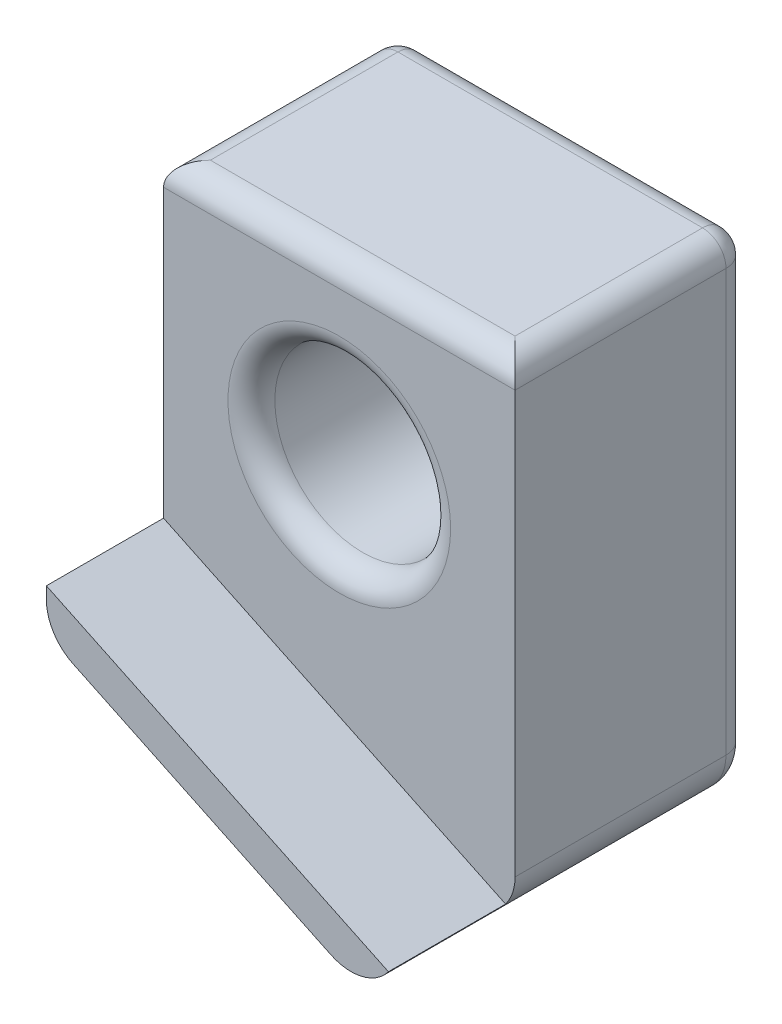
from build123d import *

# Parameters (mm, degrees)
SKETCH1_R           = 3.75
BOSS_EXTRUDE1_DEPTH = 10
BOSS_EXTRUDE2_DEPTH = 10
BOSS_EXTRUDE3_DEPTH = 5
FILLET1_R           = 2
FILLET2_R           = 1


with BuildPart() as part:
    # Sketch1 → Boss-Extrude1 (new body)
    with BuildSketch(Plane.XY):
        with BuildLine():
            Line((-7.5, 0), (-7.5, 7.5))
            Line((-7.5, 7.5), (7.5, 7.5))
            Line((7.5, 7.5), (7.5, 0))
            ThreePointArc((7.5, 0), (0, -7.5), (-7.5, 0))
        make_face()
        Circle(SKETCH1_R, mode=Mode.SUBTRACT)
    extrude(amount=BOSS_EXTRUDE1_DEPTH)

    # Sketch2 → Boss-Extrude2 (add, through all)
    with BuildSketch(Plane(origin=(0, 0, 0), x_dir=(-1, 0, 0), z_dir=(0, 0, -1))):
        with BuildLine():
            Line((-7.5, 0), (-7.5, -14.658730789))
            Line((-7.5, -14.658730789), (7.5, -7.501392953))
            Line((7.5, -7.501392953), (7.5, 0))
            ThreePointArc((7.5, 0), (0, -7.5), (-7.5, 0))
        make_face()
    extrude(amount=-BOSS_EXTRUDE2_DEPTH)

    # Sketch3 → Boss-Extrude3 (add)
    with BuildSketch(Plane.XY.offset(10)):
        Polygon((7.5, -12.885920889), (7.5, -14.658730789), (-7.5, -7.501392953), (-7.5, -5.728583054), align=None)
    extrude(amount=BOSS_EXTRUDE3_DEPTH)

    # Fillet1
    fillet1_edges = [part.edges().sort_by_distance(p)[0] for p in [
        (-7.5, -7.501392953, 7.5),
        (7.5, -14.658730789, 7.5),
    ]]
    fillet(fillet1_edges, radius=FILLET1_R)

    # Fillet2
    fillet2_edges = [part.edges().sort_by_distance(p)[0] for p in [
        (-3.75, 0, 10),
        (0, 7.5, 10),
        (-0.861287349, -10.669093569, 0),
        (7.5, -1.994203351, 0),
        (6.567104799, -13.179940725, 0),
        (-7.191534022, -7.306797089, 0),
        (-7.5, 0.630153855, 0),
        (0, 7.5, 0),
        (-7.5, 7.5, 5),
        (7.5, 7.5, 5),
    ]]
    fillet(fillet2_edges, radius=FILLET2_R)


solid = part.part
